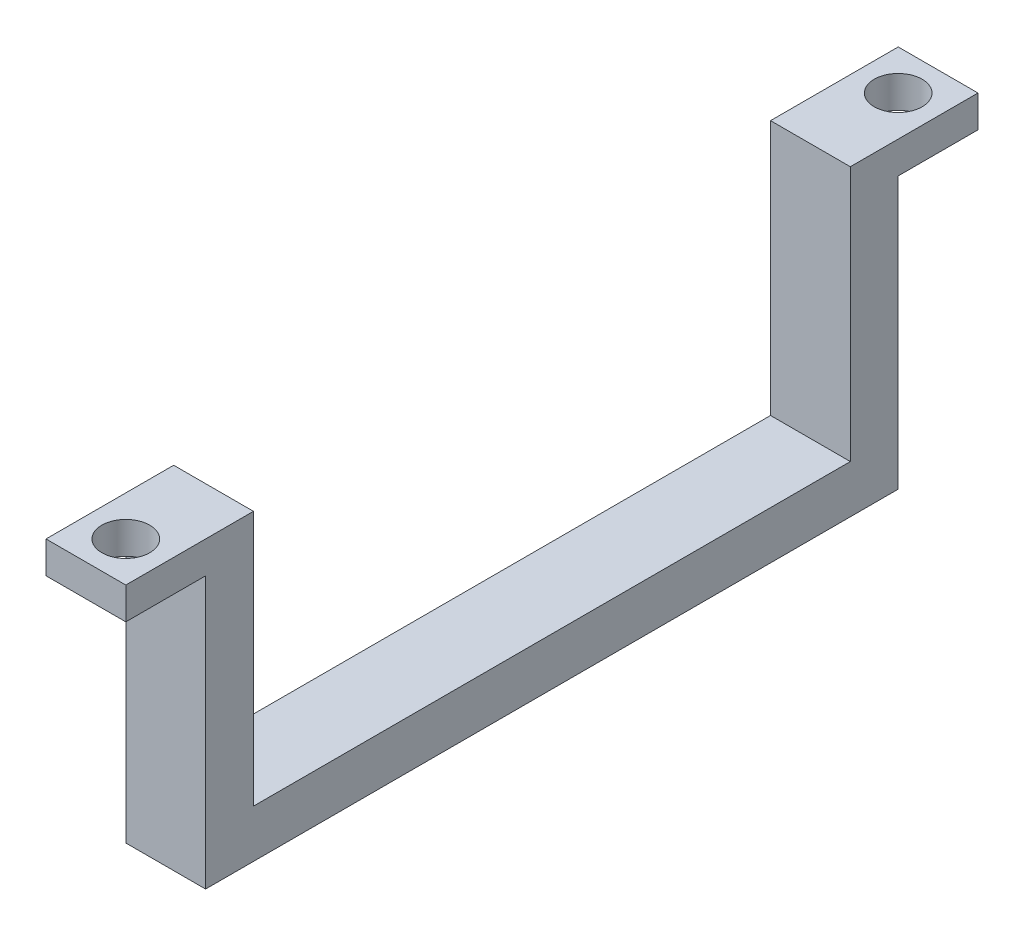
from build123d import *

# Parameters (mm, degrees)
SKETCH_1_W        = 5
SKETCH_1_H        = 8
SKETCH_1_R        = 1.5
EXTRUDE_1_DEPTH   = 2
EXTRUDE_1_2_DEPTH = 2
EXTRUDE_START     = 2
SKETCH_1_6_W      = 5
SKETCH_1_6_H      = 3
EXTRUDE_2_DEPTH   = 16
SKETCH_2_W        = 5
SKETCH_2_H        = 3
EXTRUDE_3_DEPTH   = 43.4


with BuildPart() as part:
    # 草图1 → 凸台-拉伸1 (new body)
    with BuildSketch(Plane(origin=(0, 0, 0), x_dir=(1, 0, 0), z_dir=(0, 1, 0))):
        with Locations((2.5, -4)):
            Rectangle(SKETCH_1_W, SKETCH_1_H)
        with Locations(Location((2.5, -2.5, 0), (0, 0, 270))):
            Circle(SKETCH_1_R, mode=Mode.SUBTRACT)
    extrude(amount=EXTRUDE_1_DEPTH)



with BuildPart() as body_2:
    # 草图1 → Extrude 1 2 (new body)
    with BuildSketch(Plane(origin=(0, 0, 0), x_dir=(1, 0, 0), z_dir=(0, 1, 0))):
        with Locations((2.5, -49.4)):
            Rectangle(SKETCH_1_W, SKETCH_1_H)
        with Locations(Location((2.5, -50.9, 0), (0, 0, 270))):
            Circle(SKETCH_1_R, mode=Mode.SUBTRACT)
    extrude(amount=EXTRUDE_1_2_DEPTH)


with BuildPart() as part_1:
    add(part.part)

    add(body_2.part)  # 凸台-拉伸2 merges body 2
    # 草图1<6> → 凸台-拉伸2 (add)
    with BuildSketch(Plane(origin=(0, 0, 0), x_dir=(1, 0, 0), z_dir=(0, 1, 0)).offset(EXTRUDE_START)):
        with Locations((2.5, -46.9)):
            Rectangle(SKETCH_1_6_W, SKETCH_1_6_H)
        with Locations((2.5, -6.5)):
            Rectangle(SKETCH_1_6_W, SKETCH_1_6_H)
    extrude(amount=-EXTRUDE_2_DEPTH)

    # 草图2 → 凸台-拉伸3 (add)
    with BuildSketch(Plane.XY.offset(48.4)):
        with Locations((2.5, -15.5)):
            Rectangle(SKETCH_2_W, SKETCH_2_H)
    extrude(amount=-EXTRUDE_3_DEPTH)


solid = part_1.part
